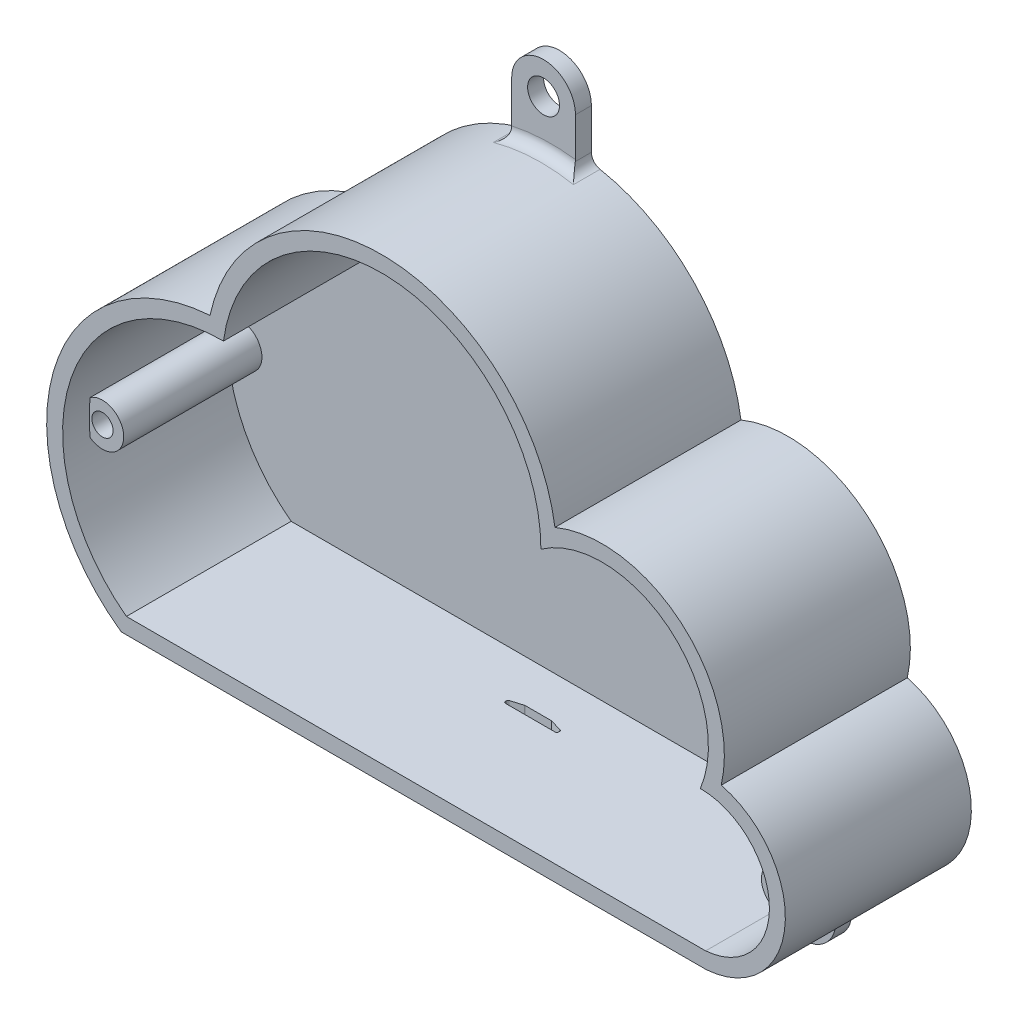
from build123d import *

# Parameters (mm, degrees)
BOSS_EXTRU_1_DEPTH      = 4
BOSS_EXTRU_3_DEPTH      = 35
ESQUISSE2_R             = 3
BOSS_EXTRU_2_DEPTH      = 3
ENL_V_MAT_EXTRU_1_REACH = 129.501
CONG_1_R                = 2
ESQUISSE7_R             = 4
ESQUISSE7_R_2           = 1.5
ESQUISSE7_R_3           = 2
BOSS_EXTRU_5_DEPTH      = 30


with BuildPart() as part:
    # Esquisse1 → Boss.-Extru.1 (new body)
    with BuildSketch(Plane.XY):
        with BuildLine():
            Line((54.5, 0), (-54.5, 0))
            ThreePointArc((-54.5, 0), (-64.919772429, 33.614061701), (-36.233707498, 54))
            ThreePointArc((-36.233707498, 54), (-4.477813337, 79.931662315), (23.49840511, 49.96135825))
            ThreePointArc((23.49840511, 49.96135825), (47.514151238, 49.231040909), (53.49840511, 25.96135825))
            ThreePointArc((53.49840511, 25.96135825), (66.48874108, 13.462528258), (54.5, 0))
        make_face()
    extrude(amount=BOSS_EXTRU_1_DEPTH)

    # Esquisse4 → Boss.-Extru.3 (add)
    with BuildSketch(Plane.XY):
        with BuildLine():
            Line((-55.473558679, -3), (54.609729917, -3))
            ThreePointArc((54.609729917, -3), (69.434198001, 11.529399821), (57.437462173, 28.468899301))
            ThreePointArc((57.437462173, 28.468899301), (49.838372291, 51.204095649), (26.142843315, 54.831384802))
            ThreePointArc((26.142843315, 54.831384802), (-5.438581775, 82.982875193), (-38.767146442, 56.92333569))
            ThreePointArc((-38.767146442, 56.92333569), (-68.289321366, 32.863500835), (-55.473558679, -3))
        make_face()
        with BuildLine():
            Line((-54.5, 0), (54.5, 0))
            ThreePointArc((54.5, 0), (66.48874108, 13.462528258), (53.49840511, 25.96135825))
            ThreePointArc((53.49840511, 25.96135825), (47.514151238, 49.231040909), (23.49840511, 49.96135825))
            ThreePointArc((23.49840511, 49.96135825), (-4.477813337, 79.931662315), (-36.233707498, 54))
            ThreePointArc((-36.233707498, 54), (-64.919772429, 33.614061701), (-54.5, 0))
        make_face(mode=Mode.SUBTRACT)
    extrude(amount=BOSS_EXTRU_3_DEPTH)

    # Esquisse2 → Boss.-Extru.2 (add)
    # profile 1 of 3: a face of its own
    with BuildSketch(Plane.XY):
        with BuildLine():
            Line((-47, -3), (-47, -15))
            ThreePointArc((-47, -15), (-41, -21), (-35, -15))
            Line((-35, -15), (-35, -3))
            Line((-35, -3), (-47, -3))
        make_face()
        with Locations((-41, -15)):
            Circle(ESQUISSE2_R, mode=Mode.SUBTRACT)
    # profile 2 of 3: a face of its own
    with BuildSketch(Plane.XY):
        with BuildLine():
            Line((35, -15), (35, -3))
            Line((35, -3), (47, -3))
            Line((47, -3), (47, -15))
            ThreePointArc((47, -15), (41, -21), (35, -15))
        make_face()
        with Locations(Location((41, -15, 0), (0, 0, 180))):
            Circle(ESQUISSE2_R, mode=Mode.SUBTRACT)
    # profile 3 of 3: a face of its own
    with BuildSketch(Plane.XY):
        with BuildLine():
            Line((-14, 82.136794295), (-14, 92))
            ThreePointArc((-14, 92), (-8, 98), (-2, 92))
            Line((-2, 92), (-2, 82.691525928))
            ThreePointArc((-2, 82.691525928), (-8.025454596, 82.964796006), (-14, 82.136794295))
        make_face()
        with Locations((-8, 92)):
            Circle(ESQUISSE2_R, mode=Mode.SUBTRACT)
    extrude(amount=BOSS_EXTRU_2_DEPTH)

    # Esquisse6 → Enlèv. mat.-Extru.1 (cut, up to next)
    with BuildSketch(Plane.XZ.offset(3), mode=Mode.PRIVATE) as enl_v_mat_extru_1_sk1:
        with BuildLine():
            Line((2.455969349, 12), (-2.455969349, 12))
            ThreePointArc((-2.455969349, 12), (-2.499533293, 12.003179881), (-2.542173715, 12.012652114))
            Line((-2.542173715, 12.012652114), (-4.786204366, 12.68586131))
            ThreePointArc((-4.786204366, 12.68586131), (-4.940687878, 12.794130036), (-5, 12.973209195))
            Line((-5, 12.973209195), (-5, 13.2))
            ThreePointArc((-5, 13.2), (-4.912132034, 13.412132034), (-4.7, 13.5))
            Line((-4.7, 13.5), (4.7, 13.5))
            ThreePointArc((4.7, 13.5), (4.912132034, 13.412132034), (5, 13.2))
            Line((5, 13.2), (5, 12.973209195))
            ThreePointArc((5, 12.973209195), (4.940687878, 12.794130036), (4.786204366, 12.68586131))
            Line((4.786204366, 12.68586131), (2.542173715, 12.012652114))
            ThreePointArc((2.542173715, 12.012652114), (2.499533293, 12.003179881), (2.455969349, 12))
        make_face()
    enl_v_mat_extru_1_tool1 = extrude(enl_v_mat_extru_1_sk1.sketch, amount=-ENL_V_MAT_EXTRU_1_REACH, mode=Mode.PRIVATE) & part.part
    add(enl_v_mat_extru_1_tool1.solids().sort_by_distance((0, -3, 12.819686))[0], mode=Mode.SUBTRACT)

    # Congé1
    cong_1_edges = [part.edges().sort_by_distance(p)[0] for p in [
        (-41, -3, 3),
        (-35, -3, 1.5),
        (-47, -3, 1.5),
        (-8.025454596, 82.964796006, 3),
        (-14, 82.136794295, 1.5),
        (-2, 82.691525928, 1.5),
        (41, -3, 3),
        (47, -3, 1.5),
        (35, -3, 1.5),
    ]]
    fillet(cong_1_edges, radius=CONG_1_R)

    # Esquisse7 → Boss.-Extru.5 (add)
    # profile 1 of 3: a face of its own
    with BuildSketch(Plane.XY):
        with Locations((0, 77.234712914)):
            Circle(ESQUISSE7_R)
        with Locations((0, 77.234712914)):
            Circle(ESQUISSE7_R_2, mode=Mode.SUBTRACT)
    # profile 2 of 3: a face of its own
    with BuildSketch(Plane.XY):
        with Locations((-64, 24)):
            Circle(ESQUISSE7_R)
        with Locations((-64, 24)):
            Circle(ESQUISSE7_R_3, mode=Mode.SUBTRACT)
    # profile 3 of 3: a face of its own
    with BuildSketch(Plane.XY):
        with Locations((64, 12)):
            Circle(ESQUISSE7_R)
        with Locations((64, 12)):
            Circle(ESQUISSE7_R_3, mode=Mode.SUBTRACT)
    extrude(amount=BOSS_EXTRU_5_DEPTH)


solid = part.part
